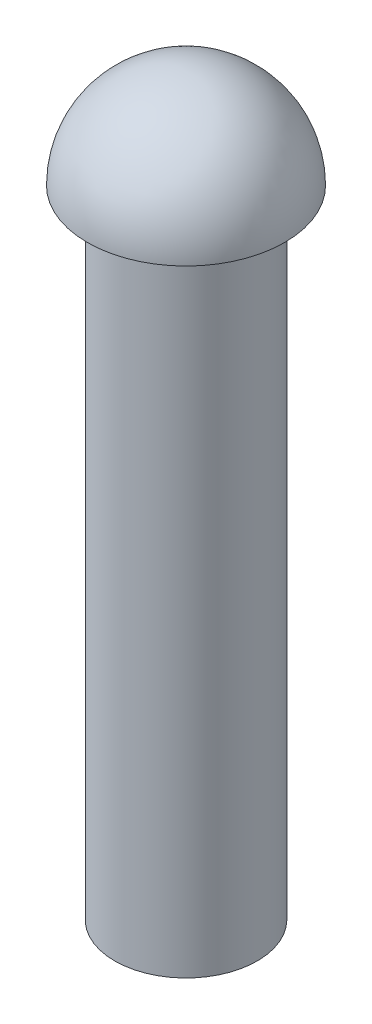
from build123d import *

# Parameters (mm, degrees)
REVOLVE_1_ANGLE = 180
SKETCH_6_W      = 6.5
SKETCH_6_H      = 58


with BuildPart() as part:
    # 草图1 → 旋转1 (revolve)
    with BuildSketch(Plane(origin=(0, 0, 0), x_dir=(1, 0, 0), z_dir=(0, 1, 0))):
        with BuildLine():
            Line((0, 9), (0, -9))
            ThreePointArc((0, -9), (9, 0), (0, 9))
        make_face()
    revolve(axis=Axis((0, 0, -9), (0, 0, 1)), revolution_arc=REVOLVE_1_ANGLE)

    # 草图6 → 旋转2 (revolve)
    with BuildSketch(Plane(origin=(0, 0, 0), x_dir=(0, 0, -1), z_dir=(1, 0, 0)), mode=Mode.PRIVATE) as revolve_2_sk:
        with Locations((3.25, -29)):
            Rectangle(SKETCH_6_W, SKETCH_6_H)
    revolve(revolve_2_sk.sketch.rotate(Axis((0, 0, 0), (0, -1, 0)), 180), axis=Axis((0, 0, 0), (0, -1, 0)))


solid = part.part
